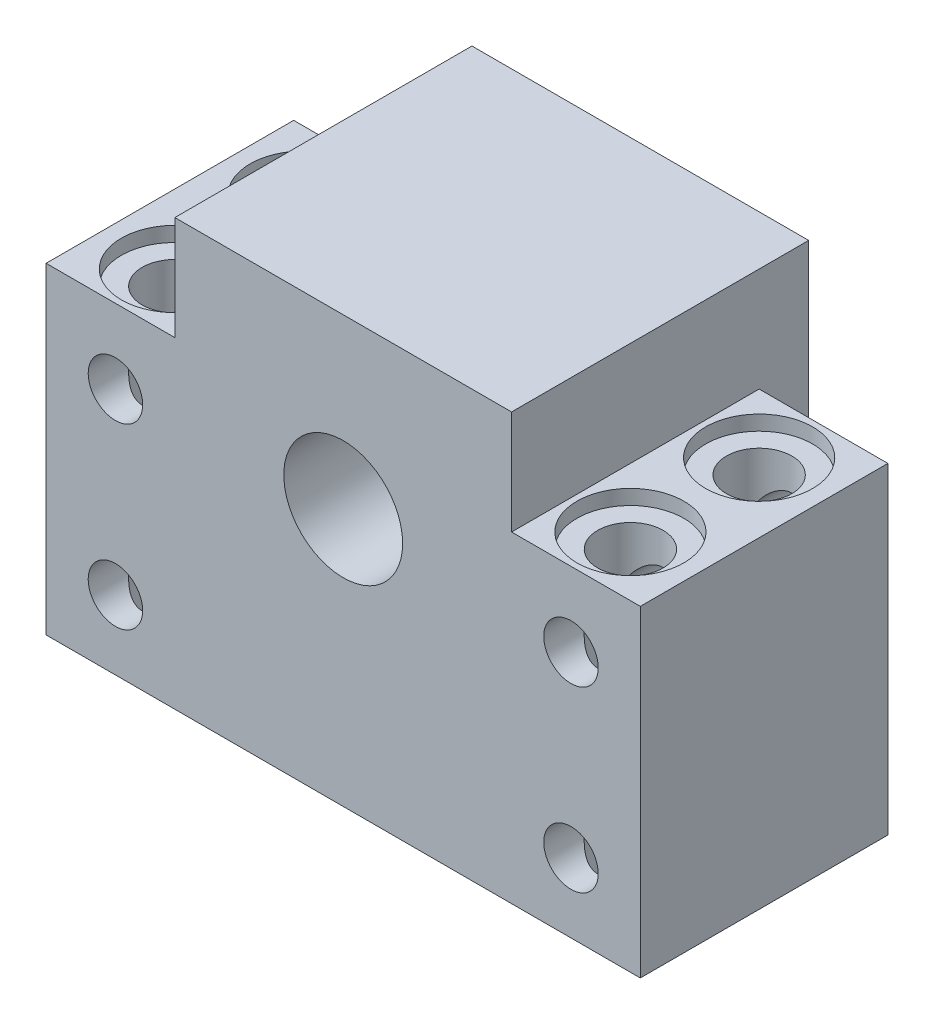
from build123d import *

# Parameters (mm, degrees)
EXTRUDE_1_DEPTH     = 25
SKETCH_2_W          = 34
SKETCH_2_H          = 34
SKETCH_2_W_2        = 26
SKETCH_2_H_2        = 26
EXTRUDE_2_DEPTH     = 5
SKETCH_2_2_W        = 26
SKETCH_2_2_H        = 26
EXTRUDE_3_DEPTH     = 9
SKETCH_3_R          = 3.3
CUT_EXTRUDE_1_DEPTH = 51.806003582
SKETCH_4_R          = 5.4
CUT_EXTRUDE_2_DEPTH = 1.5
SKETCH_5_R          = 2.75
SKETCH_5_R_2        = 6
CUT_EXTRUDE_3_DEPTH = 53.645631348


with BuildPart() as part:
    # 草图1 → 凸台-拉伸1 (new body)
    with BuildSketch(Plane.XY):
        Polygon((-17, 16.25), (-30, 16.25), (-30, -16.25), (30, -16.25), (30, 16.25), (17, 16.25), (17, 26.75), (-17, 26.75), align=None)
    extrude(amount=EXTRUDE_1_DEPTH)

    # 草图2 → 凸台-拉伸2 (add)
    with BuildSketch(Plane(origin=(0, 0, 0), x_dir=(-1, 0, 0), z_dir=(0, 0, -1))):
        with Locations((0, 9.75)):
            Rectangle(SKETCH_2_W, SKETCH_2_H)
        with Locations((0, 9.75)):
            Rectangle(SKETCH_2_W_2, SKETCH_2_H_2, mode=Mode.SUBTRACT)
    extrude(amount=EXTRUDE_2_DEPTH)

    # 草图2<2> → 凸台-拉伸3 (add)
    with BuildSketch(Plane(origin=(0, 0, 0), x_dir=(-1, 0, 0), z_dir=(0, 0, -1))):
        with Locations((0, 9.75)):
            Rectangle(SKETCH_2_2_W, SKETCH_2_2_H)
    extrude(amount=EXTRUDE_3_DEPTH)

    # 草图3 → 切除-拉伸1 (cut, through all)
    with BuildSketch(Plane(origin=(0, 16.25, 0), x_dir=(1, 0, 0), z_dir=(0, 1, 0))):
        with Locations((-23, -6)):
            Circle(SKETCH_3_R)
        with Locations((-23, -19)):
            Circle(SKETCH_3_R)
        with Locations((23, -6)):
            Circle(SKETCH_3_R)
        with Locations((23, -19)):
            Circle(SKETCH_3_R)
    extrude(amount=-CUT_EXTRUDE_1_DEPTH, mode=Mode.SUBTRACT)

    # 草图4 → 切除-拉伸2 (cut)
    with BuildSketch(Plane(origin=(0, 16.25, 0), x_dir=(1, 0, 0), z_dir=(0, 1, 0))):
        with Locations((-23, -6)):
            Circle(SKETCH_4_R)
        with Locations((-23, -19)):
            Circle(SKETCH_4_R)
        with Locations((23, -6)):
            Circle(SKETCH_4_R)
        with Locations((23, -19)):
            Circle(SKETCH_4_R)
    extrude(amount=-CUT_EXTRUDE_2_DEPTH, mode=Mode.SUBTRACT)

    # 草图5 → 切除-拉伸3 (cut, through all)
    with BuildSketch(Plane.XY.offset(25)):
        with Locations((23, -9.25)):
            Circle(SKETCH_5_R)
        with Locations((23, 8.75)):
            Circle(SKETCH_5_R)
        with Locations((-23, 8.75)):
            Circle(SKETCH_5_R)
        with Locations((-23, -9.25)):
            Circle(SKETCH_5_R)
        with Locations((0, 9.75)):
            Circle(SKETCH_5_R_2)
    extrude(amount=-CUT_EXTRUDE_3_DEPTH, mode=Mode.SUBTRACT)


solid = part.part
